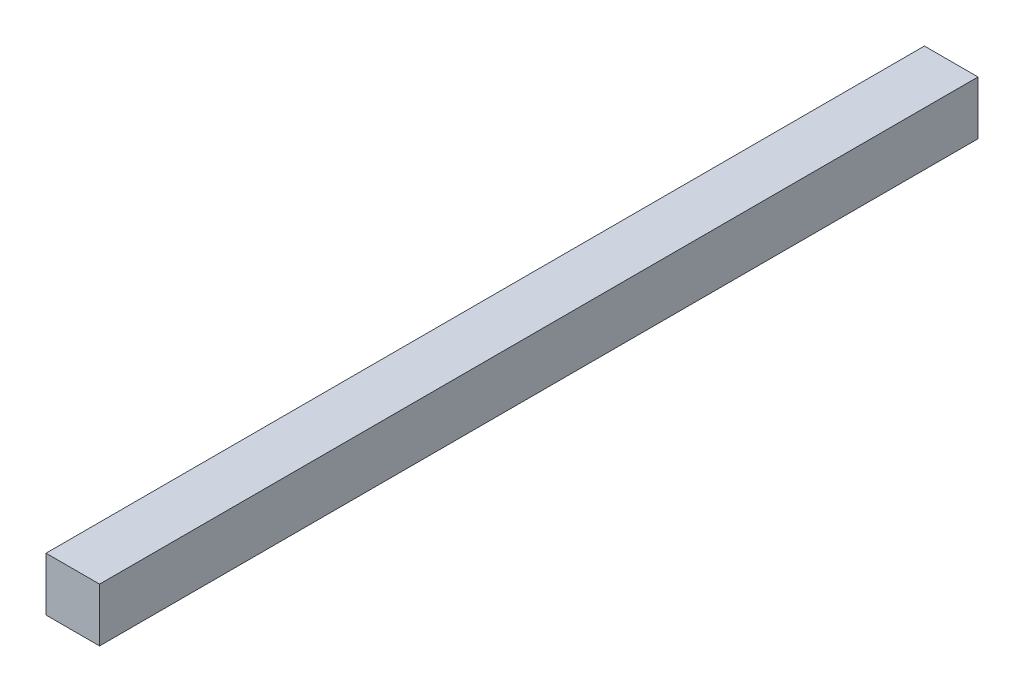
from build123d import *

# Parameters (mm, degrees)
ESQUISSE1_W        = 10
ESQUISSE1_H        = 10
BOSS_EXTRU_1_DEPTH = 164


with BuildPart() as part:
    # Esquisse1 → Boss.-Extru.1 (new body)
    with BuildSketch(Plane.XY):
        with Locations((5, 5)):
            Rectangle(ESQUISSE1_W, ESQUISSE1_H)
    extrude(amount=BOSS_EXTRU_1_DEPTH)


solid = part.part
